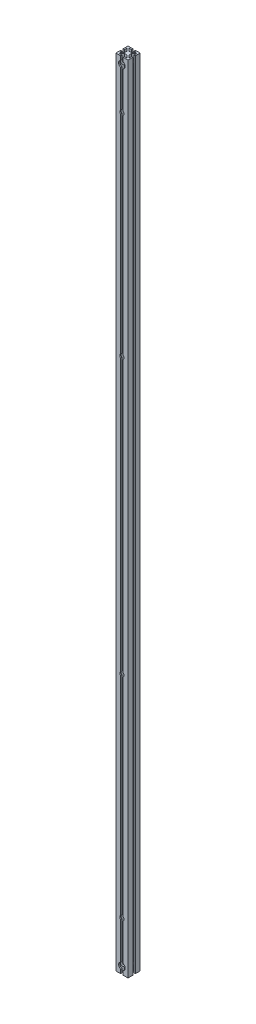
from build123d import *

# Parameters (mm, degrees)
BOSS_EXTRUDE1_DEPTH     = 2486.025
SKETCH3_R               = 10.287
CUT_EXTRUDE1_DEPTH      = 16.51
MIRROR2_COPY_1_SKETCH_R = 10.287
MIRROR2_COPY_1_DEPTH    = 16.51
SKETCH4_R               = 4.1656
CUT_EXTRUDE2_DEPTH      = 2487.389915746
SKETCH5_R               = 6.7437
CUT_EXTRUDE3_DEPTH      = 12.319


with BuildPart() as part:
    # Sketch2 → Boss-Extrude1 (new body)
    with BuildSketch(Plane(origin=(0.594697292, 0, 0.594697292), x_dir=(1, 0, 0), z_dir=(0, 1, 0))):
        Polygon((-19.644697292, 19.644697292), (-4.658697292, 19.644697292), (-4.658697292, 15.580697292), (-12.707015333, 15.580697292), (-4.477415333, 7.351097292), (3.288020749, 7.351097292), (11.517620749, 15.580697292), (3.469302708, 15.580697292), (3.469302708, 19.644697292), (18.455302708, 19.644697292), (18.455302708, 4.658697292), (14.391302708, 4.658697292), (14.391302708, 12.707015333), (6.161702708, 4.477415333), (6.161702708, -3.288020749), (14.391302708, -11.517620749), (14.391302708, -3.469302708), (18.455302708, -3.469302708), (18.455302708, -18.455302708), (3.469302708, -18.455302708), (3.469302708, -14.391302708), (11.517620749, -14.391302708), (3.288020749, -6.161702708), (-4.477415333, -6.161702708), (-12.707015333, -14.391302708), (-4.658697292, -14.391302708), (-4.658697292, -18.455302708), (-19.644697292, -18.455302708), (-19.644697292, -3.469302708), (-15.580697292, -3.469302708), (-15.580697292, -11.517620749), (-7.351097292, -3.288020749), (-7.351097292, 4.477415333), (-15.580697292, 12.707015333), (-15.580697292, 4.658697292), (-19.644697292, 4.658697292), align=None)
    extrude(amount=BOSS_EXTRUDE1_DEPTH)

    # Sketch3 → Cut-Extrude1 (cut)
    with BuildSketch(Plane.XY.offset(19.05)):
        with Locations(Location((0, 2464.181, 0), (0, 0, 48.944473627))):
            Circle(SKETCH3_R)
    cut_extrude1 = extrude(amount=-CUT_EXTRUDE1_DEPTH, mode=Mode.SUBTRACT)

    # Mirror1: Cut-Extrude1 across plane
    add(cut_extrude1.mirror(Plane.XY), mode=Mode.SUBTRACT)

    # Mirror2: Cut-Extrude1 across plane
    add(cut_extrude1.mirror(Plane.ZX.offset(1243.0125)), mode=Mode.SUBTRACT)

    # Mirror2 copy 1 sketch → Mirror2 copy 1 (cut)
    with BuildSketch(Plane(origin=(0, 2486.025, -19.05), x_dir=(1, 0, 0), z_dir=(0, 0, -1))):
        with Locations(Location((0, 2464.181, 0), (0, 0, 48.944473627))):
            Circle(MIRROR2_COPY_1_SKETCH_R)
    extrude(amount=-MIRROR2_COPY_1_DEPTH, mode=Mode.SUBTRACT)

    # Sketch4 → Cut-Extrude2 (cut, through all)
    with BuildSketch(Plane.XY.offset(19.05)):
        with Locations(Location((0, 2333.625, 0), (0, 0, 21.236863128))):
            Circle(SKETCH4_R)
        with Locations(Location((0, 1673.225, 0), (0, 0, 21.236863128))):
            Circle(SKETCH4_R)
        with Locations(Location((0, 812.8, 0), (0, 0, 338.763136872))):
            Circle(SKETCH4_R)
        with Locations(Location((0, 152.4, 0), (0, 0, 338.763136872))):
            Circle(SKETCH4_R)
    extrude(amount=-CUT_EXTRUDE2_DEPTH, mode=Mode.SUBTRACT)

    # Sketch5 → Cut-Extrude3 (cut)
    with BuildSketch(Plane.XY.offset(19.05)):
        with Locations((0, 2333.625)):
            Circle(SKETCH5_R)
        with Locations((0, 1673.225)):
            Circle(SKETCH5_R)
        with Locations((0, 812.8)):
            Circle(SKETCH5_R)
        with Locations((0, 152.4)):
            Circle(SKETCH5_R)
    extrude(amount=-CUT_EXTRUDE3_DEPTH, mode=Mode.SUBTRACT)


solid = part.part
